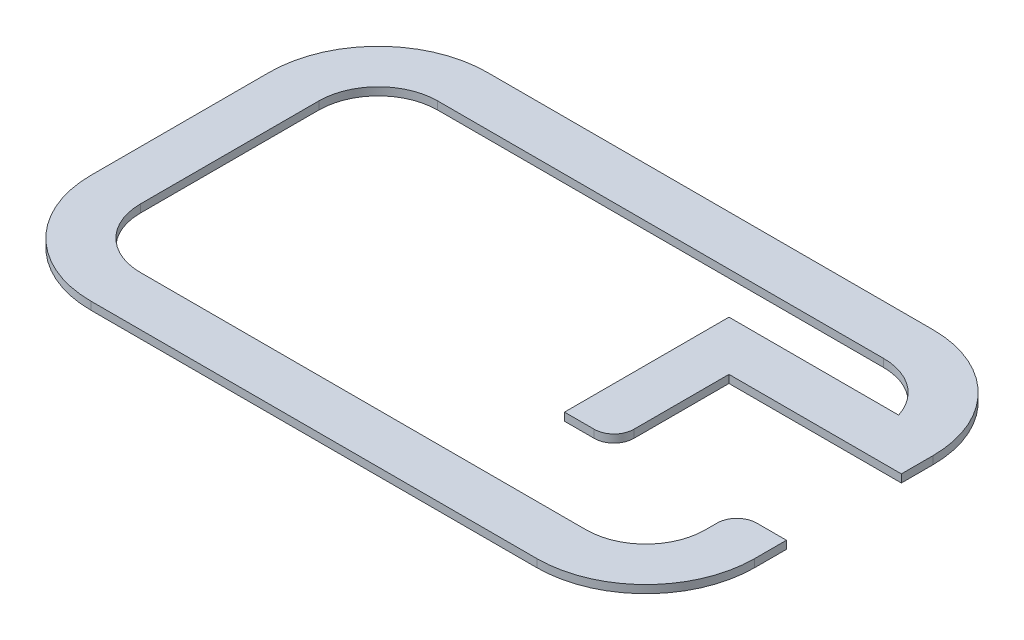
from build123d import *

# Parameters (mm, degrees)
BOSS_EXTRUDE1_DEPTH = 4


with BuildPart() as part:
    # Sketch1 → Boss-Extrude1 (new body)
    with BuildSketch(Plane(origin=(0, 0, 0), x_dir=(1, 0, 0), z_dir=(0, 1, 0))):
        with BuildLine():
            Line((223, 154), (223, 71))
            Line((223, 71), (238, 71))
            ThreePointArc((238, 71), (245.071067812, 73.928932188), (248, 81))
            Line((248, 81), (248, 129))
            Line((248, 129), (335, 129))
            Line((335, 129), (335, 145))
            ThreePointArc((335, 145), (318.890872965, 183.890872965), (280, 200))
            Line((280, 200), (55, 200))
            ThreePointArc((55, 200), (16.109127035, 183.890872965), (0, 145))
            Line((0, 145), (0, 55))
            ThreePointArc((0, 55), (16.109127035, 16.109127035), (55, 0))
            Line((55, 0), (280, 0))
            ThreePointArc((280, 0), (318.890872965, 16.109127035), (335, 55))
            Line((335, 55), (335, 71))
            Line((335, 71), (320, 71))
            ThreePointArc((320, 71), (312.928932188, 68.071067812), (310, 61))
            Line((310, 61), (310, 55))
            ThreePointArc((310, 55), (301.213203436, 33.786796564), (280, 25))
            Line((280, 25), (55, 25))
            ThreePointArc((55, 25), (33.786796564, 33.786796564), (25, 55))
            Line((25, 55), (25, 145))
            ThreePointArc((25, 145), (33.786796564, 166.213203436), (55, 175))
            Line((55, 175), (280, 175))
            ThreePointArc((280, 175), (297.748239349, 169.186773245), (308.618176043, 154))
            Line((308.618176043, 154), (223, 154))
        make_face()
    extrude(amount=BOSS_EXTRUDE1_DEPTH)


solid = part.part
